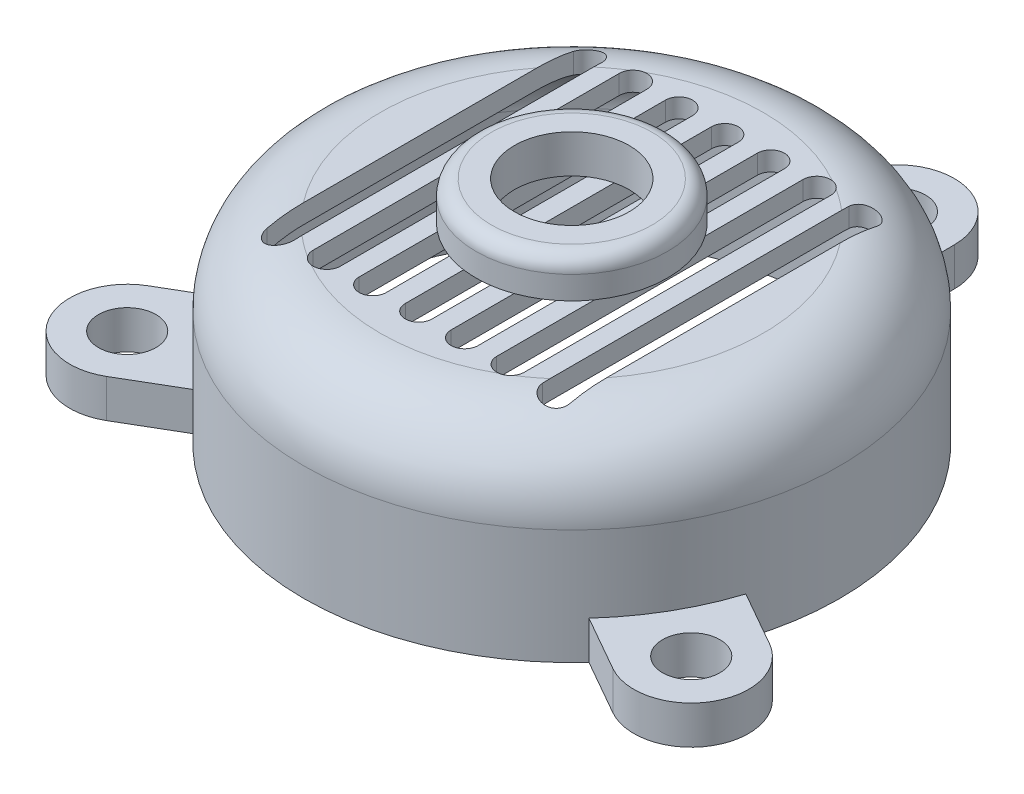
from build123d import *

# Parameters (mm, degrees)
SKETCH1_R           = 3.5
BOSS_EXTRUDE1_DEPTH = 1.25
FILLET1_R           = 1
SHELL1_T            = -0.25
CUT_EXTRUDE2_DEPTH  = 10
SKETCH4_R           = 1.25
SKETCH4_R_2         = 0.75
BOSS_EXTRUDE2_DEPTH = 0.5
FILLET2_R           = 0.2
BOSS_EXTRUDE3_START = -0.5
SKETCH5_R           = 0.375
BOSS_EXTRUDE3_DEPTH = 0.5
CIRPATTERN1_COUNT   = 3


with BuildPart() as part:
    # Sketch1 → Boss-Extrude1 (new, symmetric)
    with BuildSketch(Plane(origin=(0, 0, 0), x_dir=(1, 0, 0), z_dir=(0, 1, 0))):
        with Locations(Location((0, 0, 0), (0, 0, 270))):
            Circle(SKETCH1_R)
    extrude(amount=BOSS_EXTRUDE1_DEPTH, both=True)

    # Fillet1
    fillet1_edges = [part.edges().sort_by_distance(p)[0] for p in [
        (0, 1.25, -3.5),
    ]]
    fillet(fillet1_edges, radius=FILLET1_R)

    # Shell1
    shell1_openings = [part.faces().sort_by_distance(p)[0] for p in [
        (0, -1.25, 0),
    ]]
    offset(amount=SHELL1_T, openings=shell1_openings, kind=Kind.INTERSECTION)

    # Sketch2 → Cut-Extrude2 (cut)
    with BuildSketch(Plane(origin=(0, 1.25, 0), x_dir=(1, 0, 0), z_dir=(0, 1, 0))):
        with BuildLine():
            Line((0.175, 2), (0.175, -2))
            ThreePointArc((0.175, -2), (0, -2.175), (-0.175, -2))
            Line((-0.175, -2), (-0.175, 2))
            ThreePointArc((-0.175, 2), (0, 2.175), (0.175, 2))
        make_face()
        with BuildLine():
            Line((0.776803156, 2), (0.776803156, -2))
            ThreePointArc((0.776803156, -2), (0.6, -2.176803156), (0.423196844, -2))
            Line((0.423196844, -2), (0.423196844, 2))
            ThreePointArc((0.423196844, 2), (0.6, 2.176803156), (0.776803156, 2))
        make_face()
        with BuildLine():
            Line((1.38, 2), (1.38, -2))
            ThreePointArc((1.38, -2), (1.2, -2.18), (1.02, -2))
            Line((1.02, -2), (1.02, 2))
            ThreePointArc((1.02, 2), (1.2, 2.18), (1.38, 2))
        make_face()
        with BuildLine():
            Line((1.98, 2), (1.98, -2))
            ThreePointArc((1.98, -2), (1.8, -2.18), (1.62, -2))
            Line((1.62, -2), (1.62, 2))
            ThreePointArc((1.62, 2), (1.8, 2.18), (1.98, 2))
        make_face()
    cut_extrude2 = extrude(amount=-CUT_EXTRUDE2_DEPTH, mode=Mode.SUBTRACT)

    # Mirror1: Cut-Extrude2 across plane
    add(cut_extrude2.mirror(Plane(origin=(0, 0, 0), x_dir=(0, 0, 1), z_dir=(1, 0, 0))), mode=Mode.SUBTRACT)

    # Sketch4 → Boss-Extrude2 (add)
    with BuildSketch(Plane(origin=(0, 1.25, 0), x_dir=(1, 0, 0), z_dir=(0, 1, 0))):
        with Locations(Location((0, 0, 0), (0, 0, 81.952153753))):
            Circle(SKETCH4_R)
        with Locations(Location((0, 0, 0), (0, 0, 76.506601178))):
            Circle(SKETCH4_R_2, mode=Mode.SUBTRACT)
    extrude(amount=BOSS_EXTRUDE2_DEPTH)

    # Fillet2
    fillet2_edges = [part.edges().sort_by_distance(p)[0] for p in [
        (-0.175, 1.75, 1.237689379),
    ]]
    fillet(fillet2_edges, radius=FILLET2_R)

    # Sketch5 → Boss-Extrude3 (add)
    with BuildSketch(Plane.XZ.offset(1.25).offset(BOSS_EXTRUDE3_START)):
        with BuildLine():
            Line((3.335145109, 1.061511707), (4.053283079, 1.470293709))
            ThreePointArc((4.053283079, 1.470293709), (4.334062384, 2.493114799), (3.311241295, 2.773894105))
            Line((3.311241295, 2.773894105), (2.584467603, 2.360196434))
            ThreePointArc((2.584467603, 2.360196434), (2.823683251, 2.068045671), (3.030034408, 1.751825188))
            ThreePointArc((3.030034408, 1.751825188), (3.032448287, 1.747605061), (3.034889471, 1.74340067))
            ThreePointArc((3.034889471, 1.74340067), (3.203213742, 1.410468618), (3.335145109, 1.061511707))
        make_face()
        with Locations(Location((3.682262187, 2.122093907, 0), (0, 0, 270))):
            Circle(SKETCH5_R, mode=Mode.SUBTRACT)
    boss_extrude3 = extrude(amount=BOSS_EXTRUDE3_DEPTH)

    # CirPattern1: Boss-Extrude3 ×3 about axis
    cirpattern1_axis = Axis((0, 0, 0), (0, 1, 0))
    for i in range(1, CIRPATTERN1_COUNT):
        add(boss_extrude3.rotate(cirpattern1_axis, i * 360 / CIRPATTERN1_COUNT))


solid = part.part
